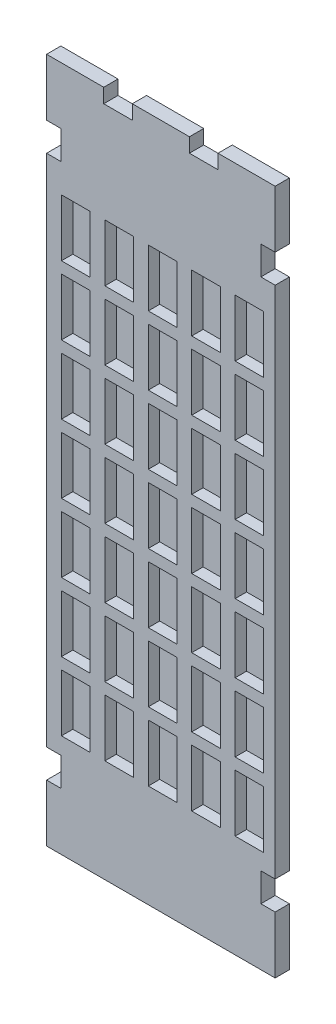
from build123d import *

# Parameters (mm, degrees)
BOSS_EXTRUDE1_DEPTH  = 3.175
SKETCH2_W            = 6.35
SKETCH2_H            = 12.7
CUT_EXTRUDE1_DEPTH   = 2.54
LPATTERN1_COUNT      = 5
LPATTERN1_PITCH      = 9.652
LPATTERN1_COUNT_DIR2 = 7
LPATTERN1_PITCH_DIR2 = 15.24


with BuildPart() as part:
    # Sketch1 → Boss-Extrude1 (new body)
    with BuildSketch(Plane.XY):
        Polygon((0, -152.4), (12.7, -152.4), (38.1, -152.4), (50.8, -152.4), (50.8, -139.7), (47.625, -139.7), (47.625, -133.35), (50.8, -133.35), (50.8, -19.05), (47.625, -19.05), (47.625, -12.7), (50.8, -12.7), (50.8, 0), (38.1, 0), (38.1, -3.175), (31.75, -3.175), (31.75, 0), (19.05, 0), (19.05, -3.175), (12.7, -3.175), (12.7, 0), (0, 0), (0, -12.7), (3.175, -12.7), (3.175, -19.05), (0, -19.05), (0, -133.35), (3.175, -133.35), (3.175, -139.7), (0, -139.7), align=None)
    extrude(amount=BOSS_EXTRUDE1_DEPTH)

    # Sketch2 → Cut-Extrude1 (cut)
    with BuildSketch(Plane.XY.offset(3.175)):
        with Locations((6.477, -31.75)):
            Rectangle(SKETCH2_W, SKETCH2_H)
    cut_extrude1 = extrude(amount=-CUT_EXTRUDE1_DEPTH, mode=Mode.SUBTRACT)

    # LPattern1: Cut-Extrude1 5 × 7
    with Locations(*[(i * LPATTERN1_PITCH, -j * LPATTERN1_PITCH_DIR2, 0) for i in range(LPATTERN1_COUNT) for j in range(LPATTERN1_COUNT_DIR2) if (i, j) != (0, 0)]):
        add(cut_extrude1, mode=Mode.SUBTRACT)


solid = part.part
